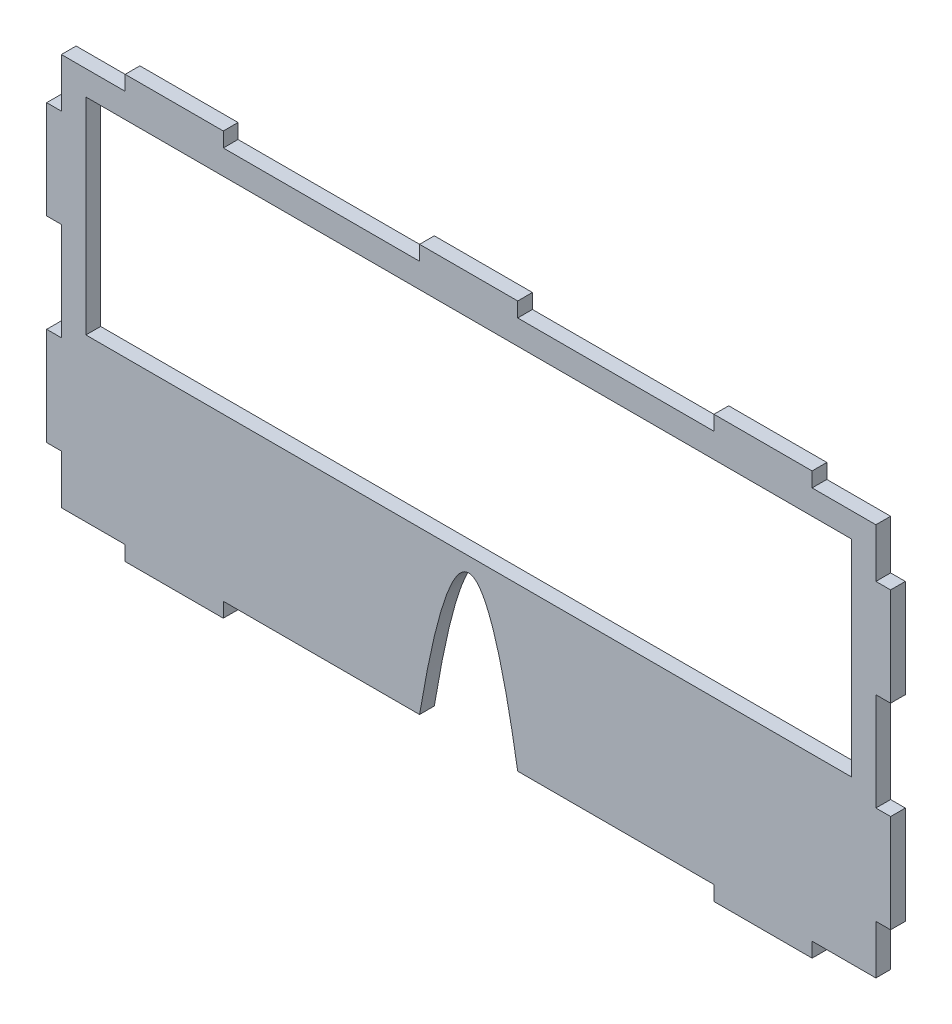
from build123d import *

# Parameters (mm, degrees)
ESQUISSE1_W        = 156
ESQUISSE1_H        = 42.000000092
BOSS_EXTRU_1_DEPTH = 3


with BuildPart() as part:
    # Esquisse1 → Boss.-Extru.1 (new body)
    with BuildSketch(Plane.XY):
        with BuildLine():
            Line((0, 0), (0, 10))
            Line((0, 10), (3, 10))
            Line((3, 10), (3, 30))
            Line((3, 30), (0, 30))
            Line((0, 30), (0, 50))
            Line((0, 50), (3, 50))
            Line((3, 50), (3, 70))
            Line((3, 70), (0, 70))
            Line((0, 70), (0, 80))
            Line((0, 80), (-13, 80))
            Line((-13, 80), (-13, 83))
            Line((-13, 83), (-33, 83))
            Line((-33, 83), (-33, 80))
            Line((-33, 80), (-73, 80))
            Line((-73, 80), (-73, 83))
            Line((-73, 83), (-93, 83))
            Line((-93, 83), (-93, 80))
            Line((-93, 80), (-133, 80))
            Line((-133, 80), (-133, 83))
            Line((-133, 83), (-153, 83))
            Line((-153, 83), (-153, 80))
            Line((-153, 80), (-166, 80))
            Line((-166, 80), (-166, 70))
            Line((-166, 70), (-169, 70))
            Line((-169, 70), (-169, 50))
            Line((-169, 50), (-166, 50))
            Line((-166, 50), (-166, 30))
            Line((-166, 30), (-169, 30))
            Line((-169, 30), (-169, 10))
            Line((-169, 10), (-166, 10))
            Line((-166, 10), (-166, 0))
            Line((-166, 0), (-153, 0))
            Line((-153, 0), (-153, -3))
            Line((-153, -3), (-133, -3))
            Line((-133, -3), (-133, 0))
            Line((-133, 0), (-92.99999998, 0))
            add(Edge.make_bspline(
                [(-92.99999998, 0), (-83, 59.999999815), (-73.00000002, 0)],
                knots=[0, 0, 0, 1, 1, 1], degree=2))
            Line((-73.00000002, 0), (-33, 0))
            Line((-33, 0), (-33, -3))
            Line((-33, -3), (-13, -3))
            Line((-13, -3), (-13, 0))
            Line((-13, 0), (0, 0))
        make_face()
        with Locations((-83, 53.999999954)):
            Rectangle(ESQUISSE1_W, ESQUISSE1_H, mode=Mode.SUBTRACT)
    extrude(amount=BOSS_EXTRU_1_DEPTH)


solid = part.part
